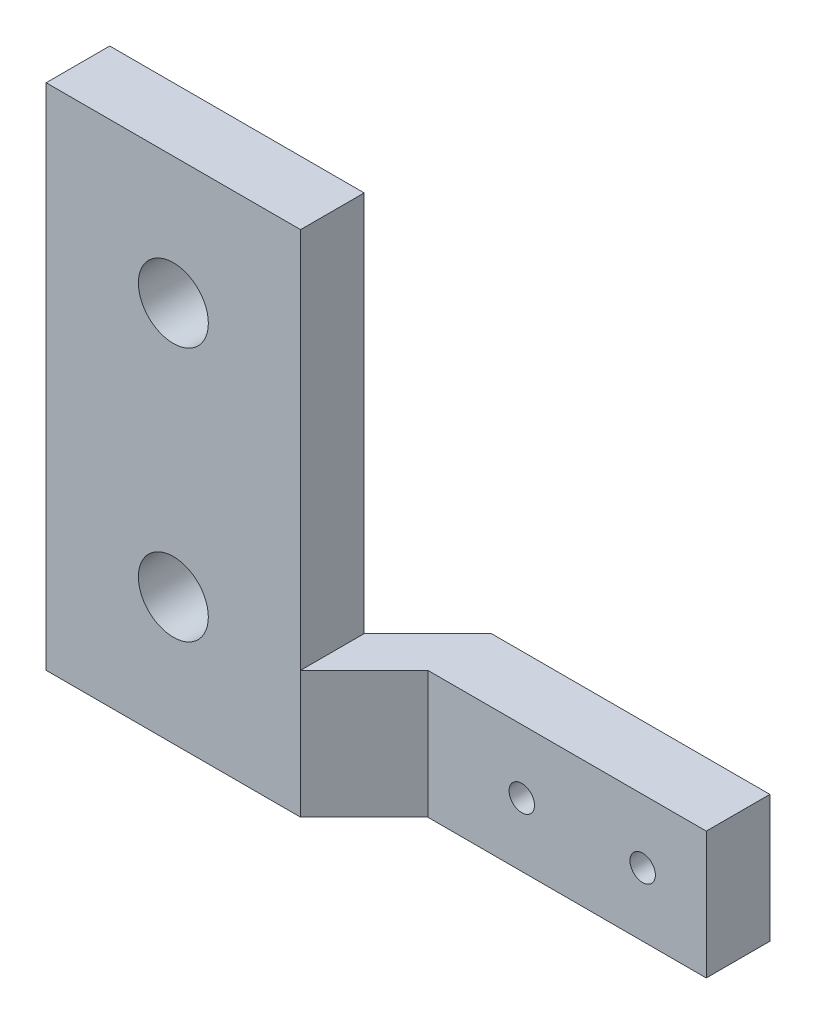
from build123d import *

# Parameters (mm, degrees)
ESQUISSE1_W             = 20
ESQUISSE1_H             = 40
ESQUISSE1_R             = 2.75
BOSS_EXTRU_1_DEPTH      = 5
BOSS_EXTRU_2_DEPTH      = 10
ENL_V_MAT_EXTRU_1_REACH = 46.697
ESQUISSE3_R             = 1


with BuildPart() as part:
    # Esquisse1 → Boss.-Extru.1 (new body)
    with BuildSketch(Plane.XY):
        with Locations((-27.825146679, -3.282272289)):
            Rectangle(ESQUISSE1_W, ESQUISSE1_H)
        with Locations((-27.825146679, 6.717727711)):
            Circle(ESQUISSE1_R, mode=Mode.SUBTRACT)
        with Locations((-27.825146679, -13.282272289)):
            Circle(ESQUISSE1_R, mode=Mode.SUBTRACT)
    extrude(amount=BOSS_EXTRU_1_DEPTH)

    # Esquisse2 → Boss.-Extru.2 (add)
    with BuildSketch(Plane.XZ.offset(23.282272289)):
        Polygon((-17.825146679, 0), (-17.825146679, 5), (-12.825146679, 0), (9.063128198, 0), (9.063128198, -5), (-12.825146679, -5), align=None)
    extrude(amount=-BOSS_EXTRU_2_DEPTH)

    # Esquisse3 → Enlèv. mat.-Extru.1 (cut, up to next)
    with BuildSketch(Plane.XY, mode=Mode.PRIVATE) as enl_v_mat_extru_1_sk1:
        with Locations((4.063128198, -18.282272289)):
            Circle(ESQUISSE3_R)
    enl_v_mat_extru_1_tool1 = extrude(enl_v_mat_extru_1_sk1.sketch, amount=-ENL_V_MAT_EXTRU_1_REACH, mode=Mode.PRIVATE) & part.part
    # Esquisse3 → Enlèv. mat.-Extru.1 (cut, up to next)
    with BuildSketch(Plane.XY, mode=Mode.PRIVATE) as enl_v_mat_extru_1_sk2:
        with Locations((-5.436871802, -18.282272289)):
            Circle(ESQUISSE3_R)
    enl_v_mat_extru_1_tool2 = extrude(enl_v_mat_extru_1_sk2.sketch, amount=-ENL_V_MAT_EXTRU_1_REACH, mode=Mode.PRIVATE) & part.part
    add(enl_v_mat_extru_1_tool1.solids().sort_by_distance((4.063128, -18.282272, 0))[0], mode=Mode.SUBTRACT)
    add(enl_v_mat_extru_1_tool2.solids().sort_by_distance((-5.436872, -18.282272, 0))[0], mode=Mode.SUBTRACT)


solid = part.part
